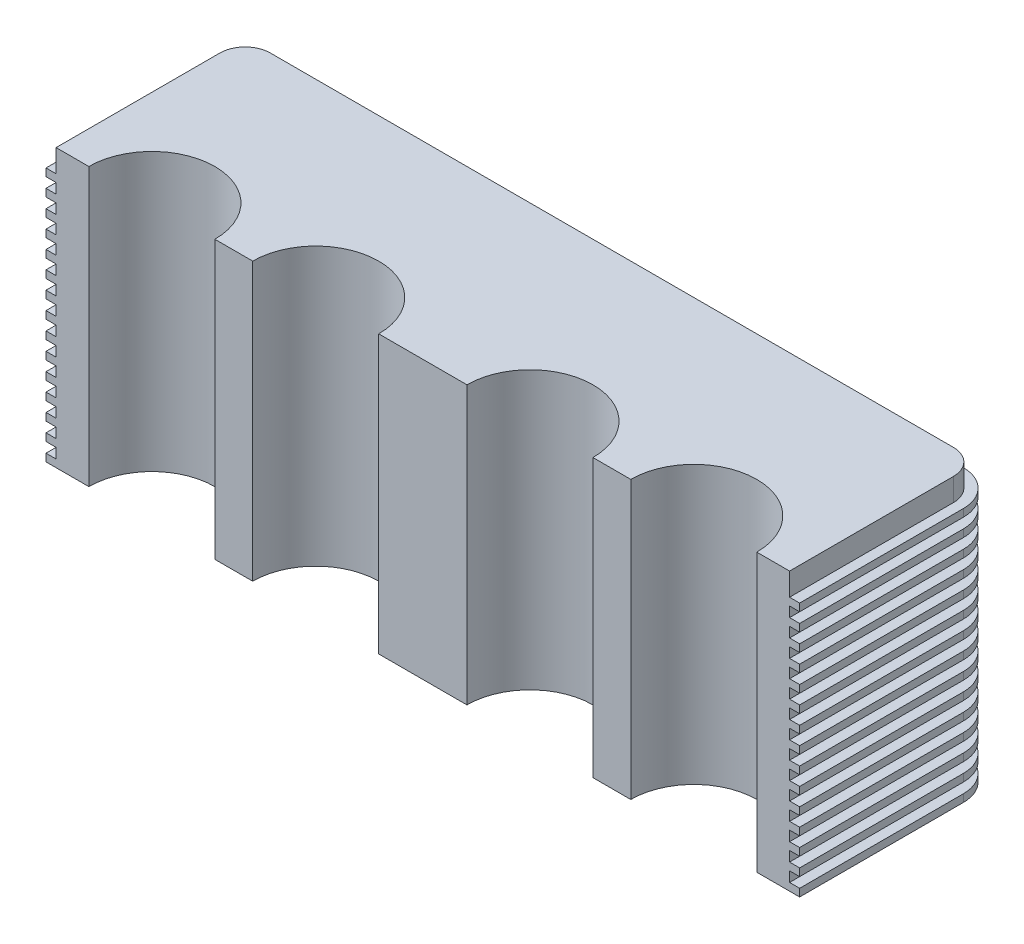
from build123d import *

# Parameters (mm, degrees)
BOSS_EXTRUDE1_DEPTH = 110
BOSS_EXTRUDE3_DEPTH = 3
LPATTERN1_COUNT     = 15
LPATTERN1_PITCH     = 7


with BuildPart() as part:
    # Sketch2 → Boss-Extrude1 (new body)
    with BuildSketch(Plane(origin=(0, 0, 0), x_dir=(1, 0, 0), z_dir=(0, 1, 0))):
        with BuildLine():
            Line((0, 0), (13, 0))
            ThreePointArc((13, 0), (38, 25), (63, 0))
            Line((63, 0), (78, 0))
            ThreePointArc((78, 0), (103, 25), (128, 0))
            Line((128, 0), (163, 0))
            ThreePointArc((163, 0), (188, 25), (213, 0))
            Line((213, 0), (228, 0))
            ThreePointArc((228, 0), (253, 25), (278, 0))
            Line((278, 0), (291, 0))
            Line((291, 0), (291, 65))
            ThreePointArc((291, 65), (288.071067812, 72.071067812), (281, 75))
            Line((281, 75), (10, 75))
            ThreePointArc((10, 75), (2.928932188, 72.071067812), (0, 65))
            Line((0, 65), (0, 0))
        make_face()
    extrude(amount=BOSS_EXTRUDE1_DEPTH)

    # Sketch4 → Boss-Extrude3 (add)
    with BuildSketch(Plane(origin=(0, 0, 0), x_dir=(1, 0, 0), z_dir=(0, 1, 0))):
        with BuildLine():
            ThreePointArc((10, 75), (2.928932188, 72.071067812), (0, 65))
            Line((0, 65), (0, 0))
            Line((0, 0), (-4, 0))
            Line((-4, 0), (-4, 65))
            ThreePointArc((-4, 65), (0.100505063, 74.899494937), (10, 79))
            Line((10, 79), (281, 79))
            ThreePointArc((281, 79), (290.899494937, 74.899494937), (295, 65))
            Line((295, 65), (295, 0))
            Line((295, 0), (291, 0))
            Line((291, 0), (291, 65))
            ThreePointArc((291, 65), (288.071067812, 72.071067812), (281, 75))
            Line((281, 75), (10, 75))
        make_face()
    boss_extrude3 = extrude(amount=BOSS_EXTRUDE3_DEPTH)

    # LPattern1: Boss-Extrude3 ×15
    with Locations(*[(0, i * LPATTERN1_PITCH, 0) for i in range(1, LPATTERN1_COUNT)]):
        add(boss_extrude3)


solid = part.part
